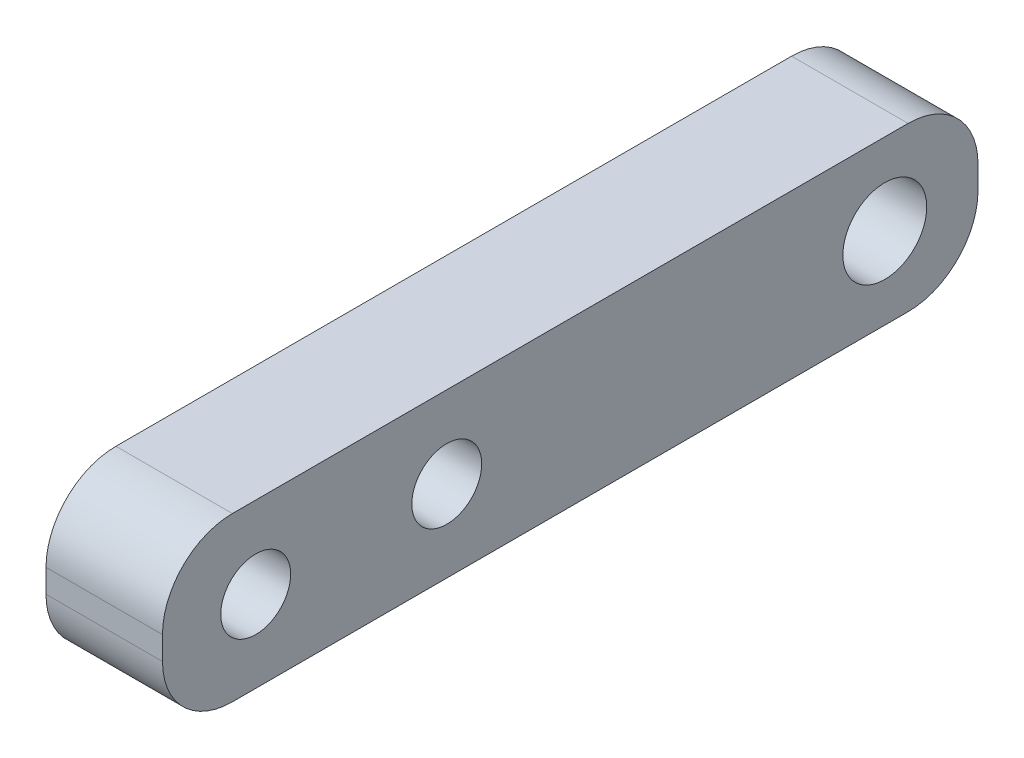
from build123d import *

# Parameters (mm, degrees)
SKETCH1_W           = 35
SKETCH1_H           = 7
BOSS_EXTRUDE1_DEPTH = 5
SKETCH2_R           = 1.5
SKETCH2_R_2         = 1.8
CUT_EXTRUDE1_DEPTH  = 37.041642582
FILLET1_R           = 3


with BuildPart() as part:
    # Sketch1 → Boss-Extrude1 (new body)
    with BuildSketch(Plane(origin=(0, 0, 0), x_dir=(0, 0, -1), z_dir=(1, 0, 0))):
        with Locations((17.5, -3.5)):
            Rectangle(SKETCH1_W, SKETCH1_H)
    extrude(amount=BOSS_EXTRUDE1_DEPTH)

    # Sketch2 → Cut-Extrude1 (cut, through all)
    with BuildSketch(Plane(origin=(5, 0, 0), x_dir=(0, 0, -1), z_dir=(1, 0, 0))):
        with Locations((4, -3.5)):
            Circle(SKETCH2_R)
        with Locations((12.2, -3.5)):
            Circle(SKETCH2_R)
        with Locations((31, -3.5)):
            Circle(SKETCH2_R_2)
    extrude(amount=-CUT_EXTRUDE1_DEPTH, mode=Mode.SUBTRACT)

    # Fillet1
    fillet1_edges = [part.edges().sort_by_distance(p)[0] for p in [
        (2.5, 0, 0),
        (2.5, 0, -35),
        (2.5, -7, -35),
        (2.5, -7, 0),
    ]]
    fillet(fillet1_edges, radius=FILLET1_R)


solid = part.part
